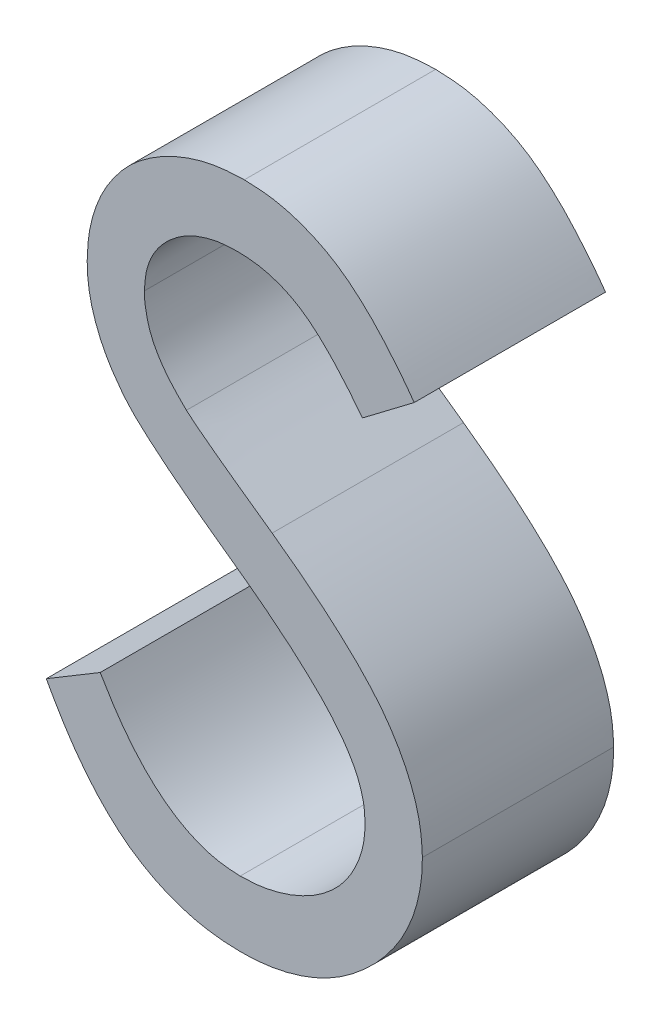
from build123d import *

# Parameters (mm, degrees)
BOSS_EXTRU_1_DEPTH = 1.5


with BuildPart() as part:
    # Esquisse1 → Boss.-Extru.1 (new body)
    with BuildSketch(Plane.XY):
        with BuildLine():
            Line((-55.945285839, -21.905575807), (-55.522609557, -21.652170358))
            add(Edge.make_bspline(
                [(-55.522609557, -21.652170358), (-55.483297789, -21.717976622), (-55.40797796, -21.844058885), (-55.282333161, -22.014427514), (-55.152143288, -22.159230595), (-55.01644424, -22.277625749), (-54.876064314, -22.370838444), (-54.730087094, -22.436841633), (-54.579004508, -22.478007312), (-54.476184763, -22.483007435), (-54.424853146, -22.485503692)],
                knots=[0, 0, 0, 0, 1.272034388, 2.437168799, 3.508375237, 4.49857839, 5.41946034, 6.295179144, 7.148887113, 8, 8, 8, 8], degree=3))
            add(Edge.make_bspline(
                [(-54.424853146, -22.485503692), (-54.381014774, -22.484282731), (-54.294105098, -22.481862173), (-54.166159037, -22.458603885), (-54.04189932, -22.422872272), (-53.92388698, -22.371699513), (-53.813750388, -22.30978739), (-53.717169394, -22.235007137), (-53.633674947, -22.151283986), (-53.565376212, -22.057880193), (-53.512976161, -21.957427124), (-53.472701778, -21.854318622), (-53.450351673, -21.746934953), (-53.446984882, -21.674634292), (-53.445285839, -21.638147922)],
                knots=[0, 0, 0, 0, 1.095163259, 2.171163733, 3.241058638, 4.321873601, 5.38011039, 6.391990106, 7.366004449, 8.327778327, 9.272591725, 10.192022065, 11.087607919, 12, 12, 12, 12], degree=3))
            add(Edge.make_bspline(
                [(-53.445285839, -21.638147922), (-53.447391997, -21.596518137), (-53.451673509, -21.511890867), (-53.487861337, -21.38703422), (-53.544788833, -21.263473405), (-53.597306895, -21.187043026), (-53.624572698, -21.147362666)],
                knots=[0, 0, 0, 0, 0.938893495, 1.908633276, 2.914225137, 4, 4, 4, 4], degree=3))
            add(Edge.make_bspline(
                [(-53.624572698, -21.147362666), (-53.646959289, -21.118724347), (-53.693957138, -21.058601777), (-53.774753585, -20.969108584), (-53.86956232, -20.876796557), (-53.975138827, -20.778140761), (-54.095328954, -20.677729623), (-54.22636826, -20.57077494), (-54.371602344, -20.461344116), (-54.473458768, -20.387954736), (-54.526015005, -20.350087025)],
                knots=[0, 0, 0, 0, 0.722233717, 1.516239348, 2.393582979, 3.351407094, 4.387010283, 5.505090956, 6.712668013, 8, 8, 8, 8], degree=3))
            add(Edge.make_bspline(
                [(-54.526015005, -20.350087025), (-54.578620714, -20.312617614), (-54.679198824, -20.240978954), (-54.819853941, -20.134658548), (-54.945631746, -20.03745302), (-55.055973198, -19.948447288), (-55.150829765, -19.867629282), (-55.230948923, -19.795775083), (-55.294289719, -19.730941425), (-55.329511977, -19.688882365), (-55.345325903, -19.669998884)],
                knots=[0, 0, 0, 0, 1.452282411, 2.77665338, 3.964542531, 5.026858415, 5.96415736, 6.766646006, 7.446254459, 8, 8, 8, 8], degree=3))
            add(Edge.make_bspline(
                [(-55.345325903, -19.669998884), (-55.367429539, -19.640568831), (-55.410899306, -19.582690683), (-55.468279313, -19.492226601), (-55.517049546, -19.399621936), (-55.555281449, -19.304627843), (-55.587476047, -19.208577945), (-55.609130234, -19.110219023), (-55.622689373, -19.009992425), (-55.624077925, -18.942544567), (-55.624773018, -18.908780935)],
                knots=[0, 0, 0, 0, 1.068054152, 2.10047183, 3.106115577, 4.101338837, 5.06977816, 6.043150881, 7.020423561, 8, 8, 8, 8], degree=3))
            add(Edge.make_bspline(
                [(-55.624773018, -18.908780935), (-55.622908434, -18.855881257), (-55.61921912, -18.751212595), (-55.588018381, -18.598311408), (-55.53877139, -18.452330812), (-55.469778693, -18.31471605), (-55.380839617, -18.189050363), (-55.277916797, -18.073888239), (-55.155328959, -17.977075978), (-55.020825212, -17.892487324), (-54.873601823, -17.826278859), (-54.719329104, -17.776334602), (-54.557761858, -17.748035662), (-54.448328809, -17.743974569), (-54.392801864, -17.741913948)],
                knots=[0, 0, 0, 0, 1.005424448, 1.989358655, 2.955360095, 3.929531133, 4.905563448, 5.876582895, 6.856512386, 7.866279853, 8.892233794, 9.918561126, 10.94386622, 12, 12, 12, 12], degree=3))
            add(Edge.make_bspline(
                [(-54.392801864, -17.741913948), (-54.333881721, -17.743946165), (-54.216708361, -17.747987595), (-54.044352339, -17.783126925), (-53.878408459, -17.841270742), (-53.74491808, -17.907254539), (-53.640442707, -17.973156562), (-53.560767374, -18.033184882), (-53.480028159, -18.10229218), (-53.397573795, -18.180662532), (-53.314801424, -18.269015033), (-53.230482207, -18.366744589), (-53.144418966, -18.473253954), (-53.089053451, -18.549288955), (-53.060670454, -18.588268115)],
                knots=[0, 0, 0, 0, 1.286793592, 2.559021753, 3.825965368, 5.121522368, 5.803751409, 6.523245864, 7.299691795, 8.125521123, 9.008227632, 9.944561021, 10.946284179, 12, 12, 12, 12], degree=3))
            Line((-53.060670454, -18.588268115), (-53.466319493, -18.895760102))
            add(Edge.make_bspline(
                [(-53.466319493, -18.895760102), (-53.490813682, -18.86420483), (-53.537983763, -18.803436754), (-53.609597316, -18.718334874), (-53.677095384, -18.640597046), (-53.743595956, -18.573075435), (-53.805586858, -18.512072387), (-53.865754061, -18.459844163), (-53.923231705, -18.415879027), (-53.995684435, -18.368959656), (-54.086709747, -18.322450365), (-54.20097337, -18.283094539), (-54.320382334, -18.259444451), (-54.401710379, -18.256317468), (-54.442881993, -18.254734461)],
                knots=[0, 0, 0, 0, 1.181633172, 2.275549214, 3.290209073, 4.226197932, 5.078386478, 5.862611352, 6.581680152, 7.217281963, 8.414376989, 9.595101626, 10.782541182, 12, 12, 12, 12], degree=3))
            add(Edge.make_bspline(
                [(-54.442881993, -18.254734461), (-54.494534167, -18.256465461), (-54.594140521, -18.259803531), (-54.735555144, -18.296260653), (-54.86283218, -18.353663311), (-54.972192987, -18.434113279), (-55.063245811, -18.529428983), (-55.129110752, -18.639113062), (-55.168753845, -18.76023078), (-55.173591387, -18.84471886), (-55.176055069, -18.887747281)],
                knots=[0, 0, 0, 0, 1.14458467, 2.207223713, 3.21896685, 4.227309161, 5.202851033, 6.127160689, 7.046193047, 8, 8, 8, 8], degree=3))
            add(Edge.make_bspline(
                [(-55.176055069, -18.887747281), (-55.17549346, -18.914535108), (-55.174369323, -18.968154564), (-55.15869104, -19.047370881), (-55.138549142, -19.12638708), (-55.106631096, -19.204847913), (-55.062566377, -19.284125569), (-55.00470184, -19.365585194), (-54.93182568, -19.449944778), (-54.876001377, -19.504812455), (-54.846527826, -19.533780935)],
                knots=[0, 0, 0, 0, 0.858281714, 1.717966888, 2.583508476, 3.4729293, 4.427298488, 5.488583878, 6.674047936, 8, 8, 8, 8], degree=3))
            add(Edge.make_bspline(
                [(-54.846527826, -19.533780935), (-54.835583008, -19.543548115), (-54.809580627, -19.566752698), (-54.76204359, -19.604741671), (-54.699268164, -19.651602774), (-54.622893591, -19.709584655), (-54.531511645, -19.776843886), (-54.425112279, -19.852520475), (-54.304881518, -19.939071131), (-54.219564495, -19.999581903), (-54.174452505, -20.03157741)],
                knots=[0, 0, 0, 0, 0.420754252, 0.999615792, 1.744751191, 2.668019286, 3.750313428, 4.999500688, 6.413464383, 8, 8, 8, 8], degree=3))
            add(Edge.make_bspline(
                [(-54.174452505, -20.03157741), (-54.120186915, -20.071065066), (-54.01510912, -20.14752744), (-53.865598292, -20.262406983), (-53.730035709, -20.374760938), (-53.607945418, -20.483871805), (-53.498121263, -20.588911938), (-53.401781662, -20.691145053), (-53.317944976, -20.789838728), (-53.227688949, -20.916370979), (-53.135463493, -21.071772528), (-53.056261339, -21.262170012), (-53.006320843, -21.453307612), (-52.999790107, -21.581774522), (-52.99656789, -21.64515914)],
                knots=[0, 0, 0, 0, 1.163667725, 2.253281268, 3.268753668, 4.215851969, 5.092017293, 5.902905408, 6.650798638, 7.335211899, 8.59617414, 9.77448103, 10.901945474, 12, 12, 12, 12], degree=3))
            add(Edge.make_bspline(
                [(-52.99656789, -21.64515914), (-52.997506659, -21.689985376), (-52.999365966, -21.778767353), (-53.0207387, -21.909131748), (-53.052052507, -22.035747276), (-53.099248556, -22.157048866), (-53.156853068, -22.275255669), (-53.229947707, -22.387266956), (-53.314672971, -22.495561811), (-53.411864064, -22.597252513), (-53.518215353, -22.690604221), (-53.630620631, -22.773645738), (-53.749263878, -22.8428862), (-53.873501473, -22.899387403), (-54.003361954, -22.943578142), (-54.138801646, -22.975596526), (-54.280043805, -22.995247542), (-54.376044493, -22.997287201), (-54.424853146, -22.998324204)],
                knots=[0, 0, 0, 0, 0.983748083, 1.948392443, 2.894712957, 3.844097841, 4.80183111, 5.778335162, 6.776009319, 7.81870978, 8.863265674, 9.881300176, 10.883814829, 11.87499822, 12.874611388, 13.892143829, 14.928324115, 16, 16, 16, 16], degree=3))
            add(Edge.make_bspline(
                [(-54.424853146, -22.998324204), (-54.462617922, -22.997593945), (-54.537671865, -22.996142623), (-54.648685411, -22.983312222), (-54.757456252, -22.965159217), (-54.862619512, -22.936339117), (-54.9655301, -22.901372007), (-55.065740435, -22.858317246), (-55.163299084, -22.806721244), (-55.258752774, -22.747728352), (-55.351858737, -22.679074431), (-55.441743691, -22.599112293), (-55.531356814, -22.510047286), (-55.618053094, -22.409460767), (-55.703586157, -22.298977792), (-55.7862696, -22.177564673), (-55.867814911, -22.045882739), (-55.918979865, -21.95321833), (-55.945285839, -21.905575807)],
                knots=[0, 0, 0, 0, 0.915332311, 1.819136955, 2.706846663, 3.586547465, 4.459518054, 5.340707479, 6.227863349, 7.133153174, 8.059268498, 9.028702269, 10.047606654, 11.120612155, 12.245963614, 13.433783089, 14.680604001, 16, 16, 16, 16], degree=3))
        make_face()
    extrude(amount=BOSS_EXTRU_1_DEPTH)


solid = part.part
